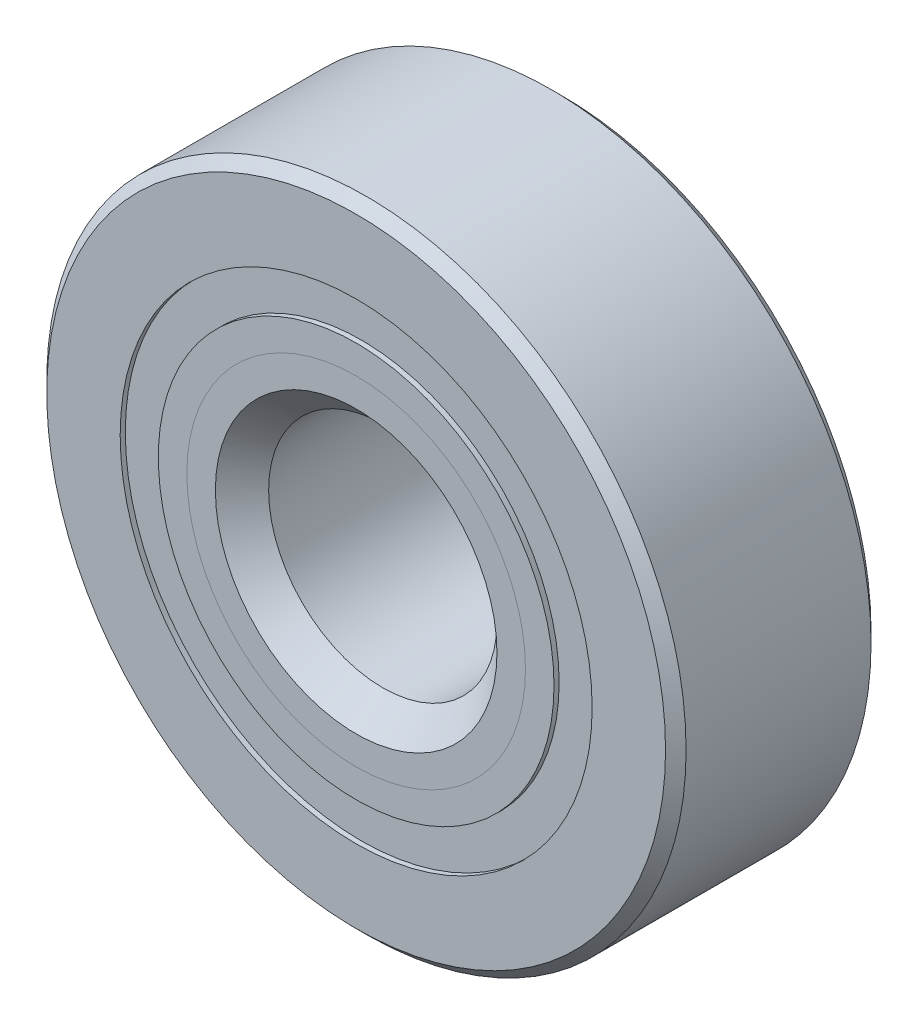
from build123d import *

# Parameters (mm, degrees)
CIRPATTERN1_COUNT = 10
SKETCH5_W         = 1.672929924
SKETCH5_H         = 1.325824176


with BuildPart() as part:
    # Sketch1 → Revolve1 (revolve)
    with BuildSketch(Plane(origin=(0, 0, 0), x_dir=(0, 0, -1), z_dir=(1, 0, 0))):
        with BuildLine():
            Line((3.2146875, 11.1125), (-3.2146875, 11.1125))
            Line((-3.2146875, 11.1125), (-3.571875, 10.7553125))
            Line((-3.571875, 10.7553125), (-3.571875, 8.203537088))
            Line((-3.571875, 8.203537088), (-1.5875, 8.203537088))
            ThreePointArc((-1.5875, 8.203537088), (0, 9.260976326), (1.5875, 8.203537088))
            Line((1.5875, 8.203537088), (3.571875, 8.203537088))
            Line((3.571875, 8.203537088), (3.571875, 10.7553125))
            Line((3.571875, 10.7553125), (3.2146875, 11.1125))
        make_face()
    revolve(axis=Axis((0, 0, 3.571875), (0, 0, -1)))


with BuildPart() as body_2:
    # Sketch2 → Revolve2 (revolve)
    with BuildSketch(Plane(origin=(0, 0, 0), x_dir=(0, 0, -1), z_dir=(1, 0, 0))):
        with BuildLine():
            Line((-3.571875, 6.877712912), (-1.5875, 6.877712912))
            ThreePointArc((-1.5875, 6.877712912), (-0.95372087, 6.108834098), (0, 5.820273674))
            Line((0, 5.820273674), (0, 4.894511837))
            Line((0, 4.894511837), (-2.580274462, 4.894511837))
            Line((-2.580274462, 4.894511837), (-3.571875, 5.886112374))
            Line((-3.571875, 5.886112374), (-3.571875, 6.877712912))
        make_face()
    revolve(axis=Axis((0, 0, 3.571875), (0, 0, -1)))


with BuildPart() as body_3:
    # Sketch3 → Revolve3 (revolve)
    with BuildSketch(Plane(origin=(0, 0, 0), x_dir=(0, 0, -1), z_dir=(1, 0, 0))):
        with BuildLine():
            Line((-3.571875, 5.886112374), (-2.580274462, 4.894511837))
            Line((-2.580274462, 4.894511837), (0, 4.894511837))
            Line((0, 4.894511837), (0, 5.820273674))
            ThreePointArc((0, 5.820273674), (0.95372087, 6.108834098), (1.5875, 6.877712912))
            Line((1.5875, 6.877712912), (3.571875, 6.877712912))
            Line((3.571875, 6.877712912), (3.571875, 4.3259375))
            Line((3.571875, 4.3259375), (3.2146875, 3.96875))
            Line((3.2146875, 3.96875), (-2.646113163, 3.96875))
            Line((-2.646113163, 3.96875), (-3.571875, 4.894511837))
            Line((-3.571875, 4.894511837), (-3.571875, 5.886112374))
        make_face()
    revolve(axis=Axis((0, 0, 3.571875), (0, 0, -1)))


with BuildPart() as body_4:
    # Sketch4 → Revolve4 (revolve)
    with BuildSketch(Plane(origin=(0, 0, 0), x_dir=(0, 0, -1), z_dir=(1, 0, 0))):
        with BuildLine():
            Line((-1.720351326, 7.540625), (1.720351326, 7.540625))
            ThreePointArc((1.720351326, 7.540625), (0, 9.260976326), (-1.720351326, 7.540625))
        make_face()
    revolve(axis=Axis((0, 7.540625, 1.720351326), (0, 0, -1)))


with BuildPart() as cirpattern1_1:
    # CirPattern1: pattern copy
    add(body_4.part.rotate(Axis((0, 0, -3.571875), (0, 0, 1)), 1 * 360 / CIRPATTERN1_COUNT))


with BuildPart() as cirpattern1_2:
    # CirPattern1: pattern copy
    add(body_4.part.rotate(Axis((0, 0, -3.571875), (0, 0, 1)), 2 * 360 / CIRPATTERN1_COUNT))


with BuildPart() as cirpattern1_3:
    # CirPattern1: pattern copy
    add(body_4.part.rotate(Axis((0, 0, -3.571875), (0, 0, 1)), 3 * 360 / CIRPATTERN1_COUNT))


with BuildPart() as cirpattern1_4:
    # CirPattern1: pattern copy
    add(body_4.part.rotate(Axis((0, 0, -3.571875), (0, 0, 1)), 4 * 360 / CIRPATTERN1_COUNT))


with BuildPart() as cirpattern1_5:
    # CirPattern1: pattern copy
    add(body_4.part.rotate(Axis((0, 0, -3.571875), (0, 0, 1)), 5 * 360 / CIRPATTERN1_COUNT))


with BuildPart() as cirpattern1_6:
    # CirPattern1: pattern copy
    add(body_4.part.rotate(Axis((0, 0, -3.571875), (0, 0, 1)), 6 * 360 / CIRPATTERN1_COUNT))


with BuildPart() as cirpattern1_7:
    # CirPattern1: pattern copy
    add(body_4.part.rotate(Axis((0, 0, -3.571875), (0, 0, 1)), 7 * 360 / CIRPATTERN1_COUNT))


with BuildPart() as cirpattern1_8:
    # CirPattern1: pattern copy
    add(body_4.part.rotate(Axis((0, 0, -3.571875), (0, 0, 1)), 8 * 360 / CIRPATTERN1_COUNT))


with BuildPart() as cirpattern1_9:
    # CirPattern1: pattern copy
    add(body_4.part.rotate(Axis((0, 0, -3.571875), (0, 0, 1)), 9 * 360 / CIRPATTERN1_COUNT))


with BuildPart() as body_14:
    # Sketch5 → Revolve5 (revolve)
    with BuildSketch(Plane(origin=(0, 0, 0), x_dir=(0, 0, -1), z_dir=(1, 0, 0))):
        with Locations((-2.556816288, 7.540625)):
            Rectangle(SKETCH5_W, SKETCH5_H)
        with Locations((2.556816288, 7.540625)):
            Rectangle(SKETCH5_W, SKETCH5_H)
    revolve(axis=Axis((0, 0, 3.571875), (0, 0, -1)))


solid = Compound([part.part, body_2.part, body_3.part, body_4.part, cirpattern1_1.part, cirpattern1_2.part, cirpattern1_3.part, cirpattern1_4.part, cirpattern1_5.part, cirpattern1_6.part, cirpattern1_7.part, cirpattern1_8.part, cirpattern1_9.part, body_14.part])
